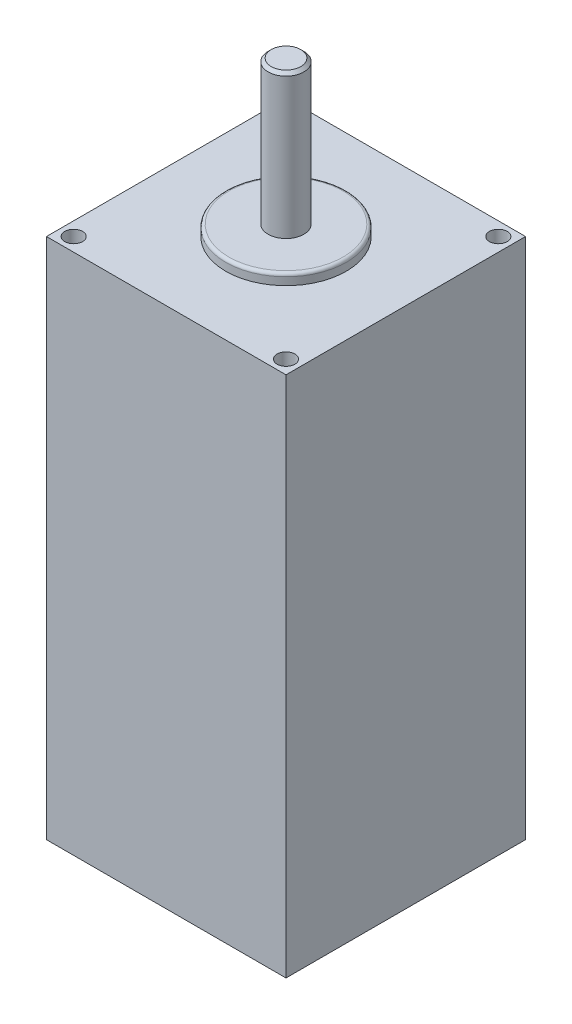
from build123d import *

# Parameters (mm, degrees)
SKETCH1_W      = 39.37
SKETCH1_H      = 85.852
EXTRUDE1_DEPTH = 39.37
SKETCH2_R      = 2.9337
EXTRUDE2_DEPTH = 25.4
CHAMFER1_SIZE  = 0.508
SKETCH4_R      = 9.906
EXTRUDE3_DEPTH = 1.778
FILLET3_R      = 0.508
SKETCH5_R      = 1.4605
EXTRUDE4_DEPTH = 12.7


with BuildPart() as part:
    # Sketch1 → Extrude1 (new body)
    with BuildSketch(Plane.XY):
        with Locations((19.685, 42.926)):
            Rectangle(SKETCH1_W, SKETCH1_H)
    extrude(amount=-EXTRUDE1_DEPTH)

    # Sketch2 → Extrude2 (add)
    with BuildSketch(Plane(origin=(0, 85.852, 0), x_dir=(1, 0, 0), z_dir=(0, 1, 0))):
        with Locations(Location((19.685, 19.685, 0), (0, 0, 270))):
            Circle(SKETCH2_R)
    extrude(amount=EXTRUDE2_DEPTH)

    # Chamfer1
    chamfer1_edges = [part.edges().sort_by_distance(p)[0] for p in [
        (19.685, 111.252, -22.6187),
    ]]
    chamfer(chamfer1_edges, length=CHAMFER1_SIZE)

    # Sketch4 → Extrude3 (add)
    with BuildSketch(Plane(origin=(0, 85.852, 0), x_dir=(1, 0, 0), z_dir=(0, 1, 0))):
        with Locations(Location((19.685, 19.685, 0), (0, 0, 270))):
            Circle(SKETCH4_R)
    extrude(amount=EXTRUDE3_DEPTH)

    # Fillet3
    fillet3_edges = [part.edges().sort_by_distance(p)[0] for p in [
        (19.685, 87.63, -29.591),
    ]]
    fillet(fillet3_edges, radius=FILLET3_R)

    # Sketch5 → Extrude4 (cut)
    with BuildSketch(Plane(origin=(0, 85.852, 0), x_dir=(1, 0, 0), z_dir=(0, 1, 0))):
        with Locations(Location((2.236362357, 37.133637643, 0), (0, 0, 270))):
            Circle(SKETCH5_R)
        with Locations(Location((37.133637643, 37.133637643, 0), (0, 0, 270))):
            Circle(SKETCH5_R)
        with Locations(Location((37.133637643, 2.236362357, 0), (0, 0, 270))):
            Circle(SKETCH5_R)
        with Locations(Location((2.236362357, 2.236362357, 0), (0, 0, 270))):
            Circle(SKETCH5_R)
    extrude(amount=-EXTRUDE4_DEPTH, mode=Mode.SUBTRACT)


solid = part.part
